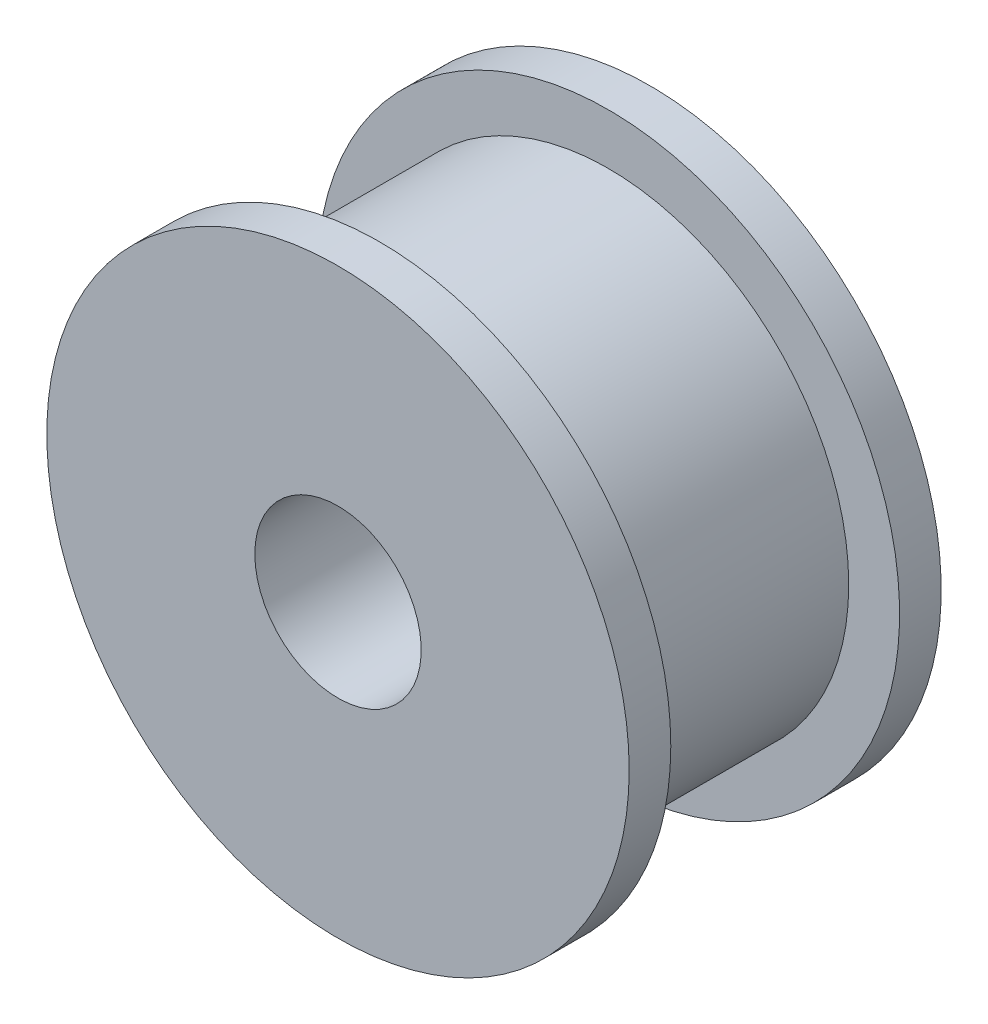
from build123d import *

# Parameters (mm, degrees)
SKETCH_1_R          = 11.555
EXTRUDE_1_DEPTH     = 11
SKETCH_2_R          = 14
EXTRUDE_2_DEPTH     = 2
EXTRUDE_START       = 2
SKETCH_3_R          = 14
EXTRUDE_3_DEPTH     = 2
SKETCH_4_R          = 4
CUT_EXTRUDE_1_DEPTH = 25.839484697


with BuildPart() as part:
    # 草图1 → 凸台-拉伸1 (new body)
    with BuildSketch(Plane.XY):
        Circle(SKETCH_1_R)
    extrude(amount=EXTRUDE_1_DEPTH)

    # 草图2 → 凸台-拉伸2 (add)
    with BuildSketch(Plane.XY.offset(11)):
        Circle(SKETCH_2_R)
    extrude(amount=EXTRUDE_2_DEPTH)

    # 草图3 → 凸台-拉伸3 (add)
    with BuildSketch(Plane(origin=(0, 0, 0), x_dir=(-1, 0, 0), z_dir=(0, 0, -1)).offset(EXTRUDE_START)):
        with Locations(Location((0, 0, 0), (0, 0, 180))):
            Circle(SKETCH_3_R)
    extrude(amount=-EXTRUDE_3_DEPTH)

    # 草图4 → 切除-拉伸1 (cut, through all)
    with BuildSketch(Plane(origin=(0, 0, -2), x_dir=(-1, 0, 0), z_dir=(0, 0, -1))):
        Circle(SKETCH_4_R)
    extrude(amount=-CUT_EXTRUDE_1_DEPTH, mode=Mode.SUBTRACT)


solid = part.part
